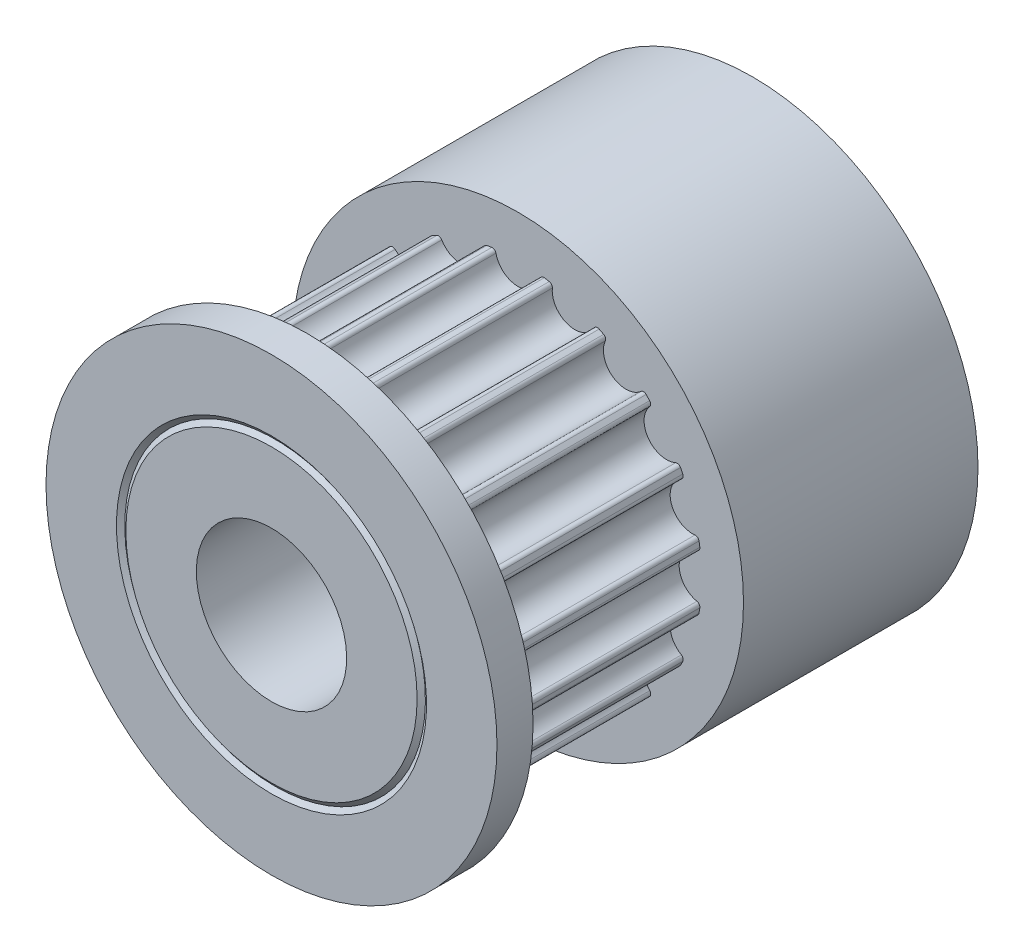
from build123d import *

# Parameters (mm, degrees)
SKETCH10_R               = 0.75
CUT_EXTRUDE3_DEPTH       = 7
FILLET3_R                = 0.125
CIRPATTERN2_COUNT        = 20
FILLET3_OF_CIRPATTERN2_R = 0.125


with BuildPart() as part:
    # Sketch3 → Revolve1 (revolve)
    with BuildSketch(Plane(origin=(0, 0, 0), x_dir=(0, 0, -1), z_dir=(1, 0, 0)), mode=Mode.PRIVATE) as revolve1_sk:
        Polygon((-8.2, 5.156387045), (-8.08, 5), (-8.2, 4.843612955), (-8.2, 2.5), (7.8, 2.5), (7.8, 4.843612955), (7.68, 5), (7.8, 5.156387045), (7.8, 7.5), (0, 7.5), (0, 6.11), (-7, 6.11), (-7, 7.5), (-8.2, 7.5), align=None)
    revolve(revolve1_sk.sketch.rotate(Axis((0, 0, 8.2), (0, 0, -1)), 180), axis=Axis((0, 0, 8.2), (0, 0, -1)))

    # Sketch10 → Cut-Extrude3 (cut)
    with BuildSketch(Plane.XY):
        with Locations((0, 6.11)):
            Circle(SKETCH10_R)
    cut_extrude3 = extrude(amount=CUT_EXTRUDE3_DEPTH, mode=Mode.SUBTRACT)

    # Fillet3
    fillet3_edges = [part.edges().sort_by_distance(p)[0] for p in [
        (-0.748586093, 6.063968903, 3.5),
        (0.748586093, 6.063968903, 3.5),
    ]]
    fillet(fillet3_edges, radius=FILLET3_R)

    # CirPattern2: Cut-Extrude3 ×20 about axis
    cirpattern2_axis = Axis((0, 0, 0), (0, 0, 1))
    for i in range(1, CIRPATTERN2_COUNT):
        add(cut_extrude3.rotate(cirpattern2_axis, i * 360 / CIRPATTERN2_COUNT), mode=Mode.SUBTRACT)

    # Fillet3 of CirPattern2
    fillet3_of_cirpattern2_edges = [part.edges().sort_by_distance(p)[0] for p in [
        (-2.585817126, 5.535851316, 3.5),
        (-1.161921763, 5.998502965, 3.5),
        (-4.169930363, 4.465846031, 3.5),
        (-2.958692621, 5.345861762, 3.5),
        (-5.345861762, 2.958692621, 3.5),
        (-4.465846031, 4.169930363, 3.5),
        (-5.998502965, 1.161921763, 3.5),
        (-5.535851316, 2.585817126, 3.5),
        (-6.063968903, -0.748586093, 3.5),
        (-6.063968903, 0.748586093, 3.5),
        (-5.535851316, -2.585817126, 3.5),
        (-5.998502965, -1.161921763, 3.5),
        (-4.465846031, -4.169930363, 3.5),
        (-5.345861762, -2.958692621, 3.5),
        (-2.958692621, -5.345861762, 3.5),
        (-4.169930363, -4.465846031, 3.5),
        (-1.161921763, -5.998502965, 3.5),
        (-2.585817126, -5.535851316, 3.5),
        (0.748586093, -6.063968903, 3.5),
        (-0.748586093, -6.063968903, 3.5),
        (2.585817126, -5.535851316, 3.5),
        (1.161921763, -5.998502965, 3.5),
        (4.169930363, -4.465846031, 3.5),
        (2.958692621, -5.345861762, 3.5),
        (5.345861762, -2.958692621, 3.5),
        (4.465846031, -4.169930363, 3.5),
        (5.998502965, -1.161921763, 3.5),
        (5.535851316, -2.585817126, 3.5),
        (6.063968903, 0.748586093, 3.5),
        (6.063968903, -0.748586093, 3.5),
        (5.535851316, 2.585817126, 3.5),
        (5.998502965, 1.161921763, 3.5),
        (4.465846031, 4.169930363, 3.5),
        (5.345861762, 2.958692621, 3.5),
        (2.958692621, 5.345861762, 3.5),
        (4.169930363, 4.465846031, 3.5),
        (1.161921763, 5.998502965, 3.5),
        (2.585817126, 5.535851316, 3.5),
    ]]
    fillet(fillet3_of_cirpattern2_edges, radius=FILLET3_OF_CIRPATTERN2_R)


solid = part.part
